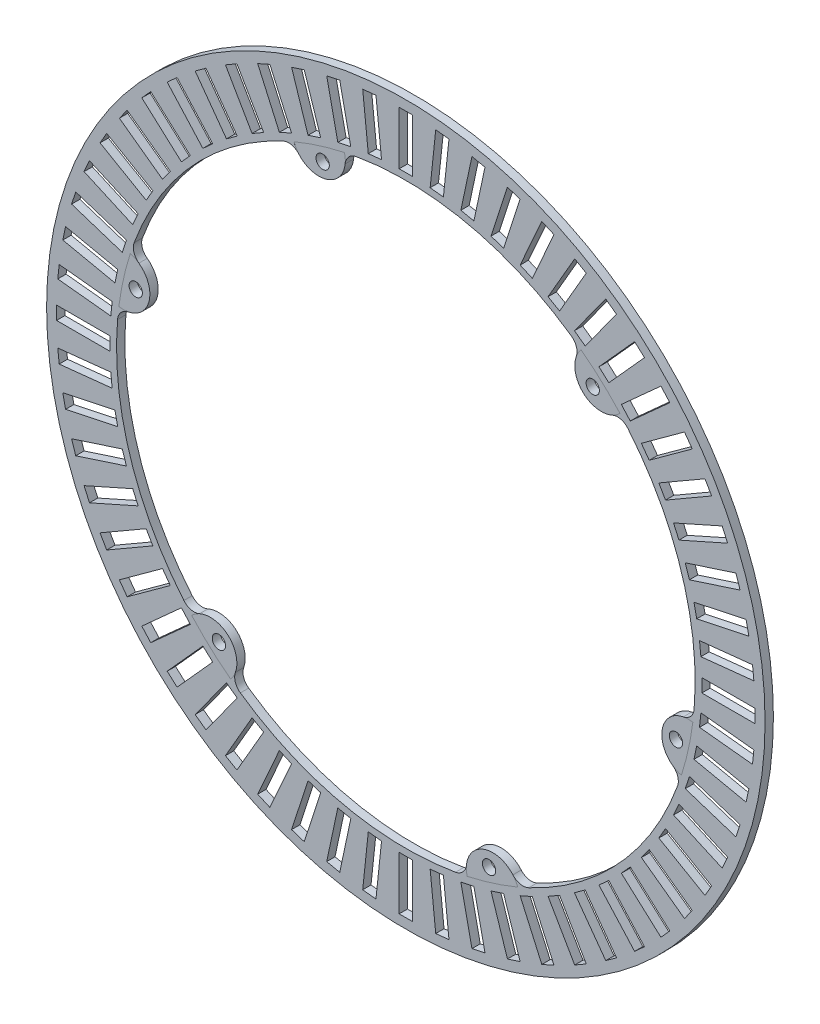
from build123d import *

# Parameters (mm, degrees)
SKETCH1_R                 = 68.500625
SKETCH1_R_2               = 55.165625
BOSS_EXTRUDE1_DEPTH       = 1.5875
SKETCH4_W                 = 2.54
SKETCH4_H                 = 10.16
CUT_EXTRUDE3_DEPTH        = 5.08
CIRPATTERN2_COUNT         = 60
BOSS_EXTRUDE2_START       = -1.5875
BOSS_EXTRUDE2_DEPTH       = 1.587512
FILLET1_R                 = 2.54
SKETCH9_R                 = 1.27
CUT_EXTRUDE6_DEPTH        = 97.887519696
CIRPATTERN12_COUNT        = 6
FILLET1_OF_CIRPATTERN12_R = 2.54


with BuildPart() as part:
    # Sketch1 → Boss-Extrude1 (new body)
    with BuildSketch(Plane.XY):
        Circle(SKETCH1_R)
        Circle(SKETCH1_R_2, mode=Mode.SUBTRACT)
    extrude(amount=BOSS_EXTRUDE1_DEPTH)

    # Sketch4 → Cut-Extrude3 (cut)
    with BuildSketch(Plane.XY.offset(1.5875)):
        with Locations((0, 61.515625)):
            Rectangle(SKETCH4_W, SKETCH4_H)
    cut_extrude3 = extrude(amount=-CUT_EXTRUDE3_DEPTH, mode=Mode.SUBTRACT)

    # CirPattern2: Cut-Extrude3 ×60 about axis
    cirpattern2_axis = Axis((0, 0, 0), (0, 0, 1))
    for i in range(1, CIRPATTERN2_COUNT):
        add(cut_extrude3.rotate(cirpattern2_axis, i * 360 / CIRPATTERN2_COUNT), mode=Mode.SUBTRACT)

    # Sketch8 → Boss-Extrude2 (add)
    with BuildSketch(Plane.XY.offset(1.5875).offset(BOSS_EXTRUDE2_START)):
        with BuildLine():
            ThreePointArc((54.724288949, -6.964077875), (48.926905763, -10.846833867), (52.540195701, -16.815885863))
            ThreePointArc((52.540195701, -16.815885863), (53.857979418, -11.940026578), (54.724288949, -6.964077875))
        make_face()
    boss_extrude2 = extrude(amount=BOSS_EXTRUDE2_DEPTH)

    # Fillet1
    fillet1_edges = [part.edges().sort_by_distance(p)[0] for p in [
        (54.724288949, -6.964077875, 0.79375),
        (52.540195701, -16.815885863, 0.79375),
    ]]
    fillet(fillet1_edges, radius=FILLET1_R)

    # Sketch9 → Cut-Extrude6 (cut, symmetric)
    with BuildSketch(Plane.XY.offset(1.587512)):
        with Locations((51.503613417, -11.418076201)):
            Circle(SKETCH9_R)
    cut_extrude6 = extrude(amount=CUT_EXTRUDE6_DEPTH, both=True, mode=Mode.SUBTRACT)

    # CirPattern12: Boss-Extrude2, Cut-Extrude6 ×6 about axis
    cirpattern12_axis = Axis((0, 0, 0), (0, 0, 1))
    add([boss_extrude2.rotate(cirpattern12_axis, i * 360 / CIRPATTERN12_COUNT) for i in range(1, CIRPATTERN12_COUNT)])
    add([cut_extrude6.rotate(cirpattern12_axis, i * 360 / CIRPATTERN12_COUNT) for i in range(1, CIRPATTERN12_COUNT)], mode=Mode.SUBTRACT)

    # Fillet1 of CirPattern12
    fillet1_of_cirpattern12_edges = [part.edges().sort_by_distance(p)[0] for p in [
        (33.393212829, 43.910585496, 0.79375),
        (40.833082195, 37.093201266, 0.79375),
        (-21.33107612, 50.874663372, 0.79375),
        (-11.707113506, 53.909087128, 0.79375),
        (-54.724288949, 6.964077875, 0.79375),
        (-52.540195701, 16.815885863, 0.79375),
        (-33.393212829, -43.910585496, 0.79375),
        (-40.833082195, -37.093201266, 0.79375),
        (21.33107612, -50.874663372, 0.79375),
        (11.707113506, -53.909087128, 0.79375),
    ]]
    fillet(fillet1_of_cirpattern12_edges, radius=FILLET1_OF_CIRPATTERN12_R)


solid = part.part
